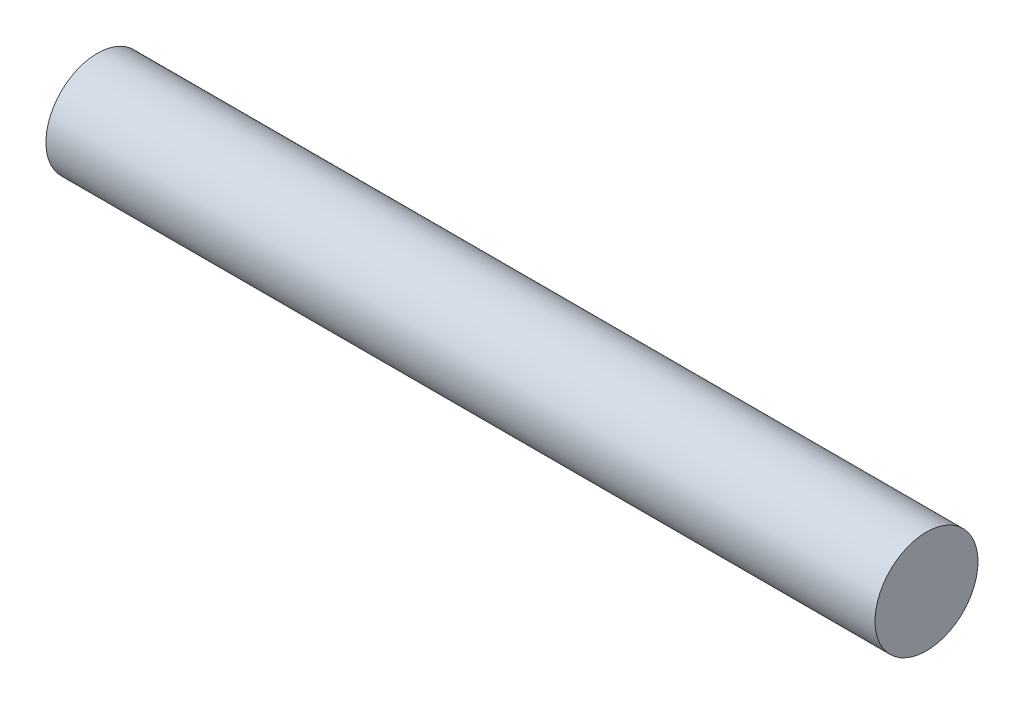
from build123d import *

# Parameters (mm, degrees)
SKETCH2_R           = 102.108
BOSS_EXTRUDE1_DEPTH = 1644.142


with BuildPart() as part:
    # Sketch2 → Boss-Extrude1 (new body)
    with BuildSketch(Plane(origin=(0, 0, 0), x_dir=(0, 0, -1), z_dir=(1, 0, 0))):
        Circle(SKETCH2_R)
    extrude(amount=BOSS_EXTRUDE1_DEPTH)


solid = part.part
